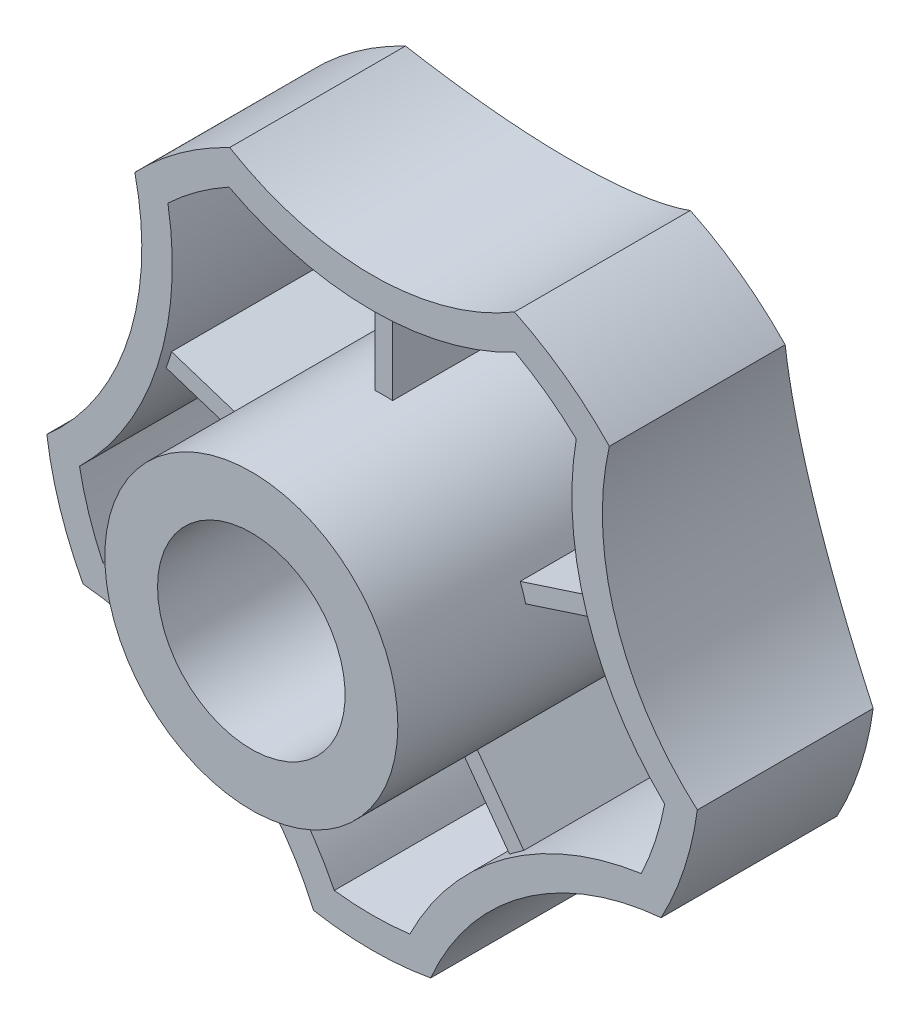
from build123d import *

# Parameters (mm, degrees)
BOSS_EXTRU_1_DEPTH           = 20
COQUE1_T                     = -2.6
BOSS_EXTRU_2_REACH           = 51.719
BOSS_EXTRU_2_END_RADIUS      = 78.3
ESQUISSE4_R                  = 12.5
NERVURE1_REACH               = 45.628
ESQUISSE6_WALLS_W            = 1.5
ESQUISSE6_WALLS_H            = 96.027794688
R_P_TITION_CIRCULAIRE1_COUNT = 5


with BuildPart() as part:
    # Esquisse1 → Boss.-Extru.1 (new body)
    with BuildSketch(Plane.XY):
        with BuildLine():
            ThreePointArc((-12.14837206, 25.22730775), (-16.457987064, 22.652475842), (-20.238542003, 19.349455227))
            ThreePointArc((-20.238542003, 19.349455227), (-20.800515992, 6.758497338), (-27.746648844, -3.758121593))
            ThreePointArc((-27.746648844, -3.758121593), (-26.629582456, -8.652475842), (-24.656478901, -13.268686756))
            ThreePointArc((-24.656478901, -13.268686756), (-12.855425866, -17.693975742), (-5, -27.549954628))
            ThreePointArc((-5, -27.549954628), (0, -28), (5, -27.549954628))
            ThreePointArc((5, -27.549954628), (12.855425866, -17.693975742), (24.656478901, -13.268686756))
            ThreePointArc((24.656478901, -13.268686756), (26.629582456, -8.652475842), (27.746648844, -3.758121593))
            ThreePointArc((27.746648844, -3.758121593), (20.800515992, 6.758497338), (20.238542003, 19.349455227))
            ThreePointArc((20.238542003, 19.349455227), (16.457987064, 22.652475842), (12.14837206, 25.22730775))
            ThreePointArc((12.14837206, 25.22730775), (0, 21.87095681), (-12.14837206, 25.22730775))
        make_face()
    extrude(amount=BOSS_EXTRU_1_DEPTH)

    # Esquisse3 → Enlèvement de matière-Révolution3 (revolve, cut)
    with BuildSketch(Plane(origin=(0, 0, 0), x_dir=(0, 0, -1), z_dir=(1, 0, 0)), mode=Mode.PRIVATE) as enl_vement_de_mati_re_r_volution3_sk:
        with BuildLine():
            Line((-5, -28), (3.997916613, -28))
            Line((3.997916613, -28), (3.997916613, 0))
            Line((3.997916613, 0), (0, 0))
            ThreePointArc((0, 0), (-1.259809141, -14.221462653), (-5, -28))
        make_face()
    revolve(enl_vement_de_mati_re_r_volution3_sk.sketch.rotate(Axis((0, 0, 0), (0, 0, 1)), 180), axis=Axis((0, 0, 0), (0, 0, 1)), mode=Mode.SUBTRACT)

    # Coque1
    coque1_openings = [part.faces().sort_by_distance(p)[0] for p in [
        (0, 0, 20),
    ]]
    offset(amount=COQUE1_T, openings=coque1_openings)

    # Boss.-Extru.2: up to this sphere (the profile starts inside it)
    boss_extru_2_end = Location((0, 0, 80.9)) * Sphere(BOSS_EXTRU_2_END_RADIUS, mode=Mode.PRIVATE)
    # Esquisse4 → Boss.-Extru.2 (add, up to the surface)
    with BuildSketch(Plane.XY.offset(30.3), mode=Mode.PRIVATE) as boss_extru_2_sk1:
        Circle(ESQUISSE4_R)
    boss_extru_2_tool1 = extrude(boss_extru_2_sk1.sketch, amount=-BOSS_EXTRU_2_REACH, mode=Mode.PRIVATE) & boss_extru_2_end
    add(boss_extru_2_tool1.solids().sort_by_distance((0, 0, 30.3))[0])

    # Esquisse5 → Enlèvement de matière-Révolution4 (revolve, cut)
    with BuildSketch(Plane(origin=(0, 0, 0), x_dir=(1, 0, 0), z_dir=(0, 1, 0)), mode=Mode.PRIVATE) as enl_vement_de_mati_re_r_volution4_sk:
        Polygon((0, -30.3), (8, -30.3), (8, -14.3), (7, -14.3), (7, 4.215006275), (0, 4.215006275), align=None)
    revolve(enl_vement_de_mati_re_r_volution4_sk.sketch.rotate(Axis((0, 0, 0), (0, 0, 1)), 115.713439389), axis=Axis((0, 0, 0), (0, 0, 1)), mode=Mode.SUBTRACT)

    # Esquisse6 walls → Nervure1 (add, up to next)
    with BuildSketch(Plane.XY.offset(19), mode=Mode.PRIVATE) as nervure1_sk1:
        with Locations((0, 15.885478405)):
            Rectangle(ESQUISSE6_WALLS_W, ESQUISSE6_WALLS_H)
    nervure1_tool1 = extrude(nervure1_sk1.sketch, amount=-NERVURE1_REACH, mode=Mode.PRIVATE) - part.part
    nervure1 = nervure1_tool1.solids().sort_by_distance((0, 15.885478405, 19))[0]
    add(nervure1)

    # Répétition circulaire1: Nervure1 ×5 about axis
    r_p_tition_circulaire1_axis = Axis((0, 0, 0), (0, 0, -1))
    for i in range(1, R_P_TITION_CIRCULAIRE1_COUNT):
        add(nervure1.rotate(r_p_tition_circulaire1_axis, i * 360 / R_P_TITION_CIRCULAIRE1_COUNT))


solid = part.part
